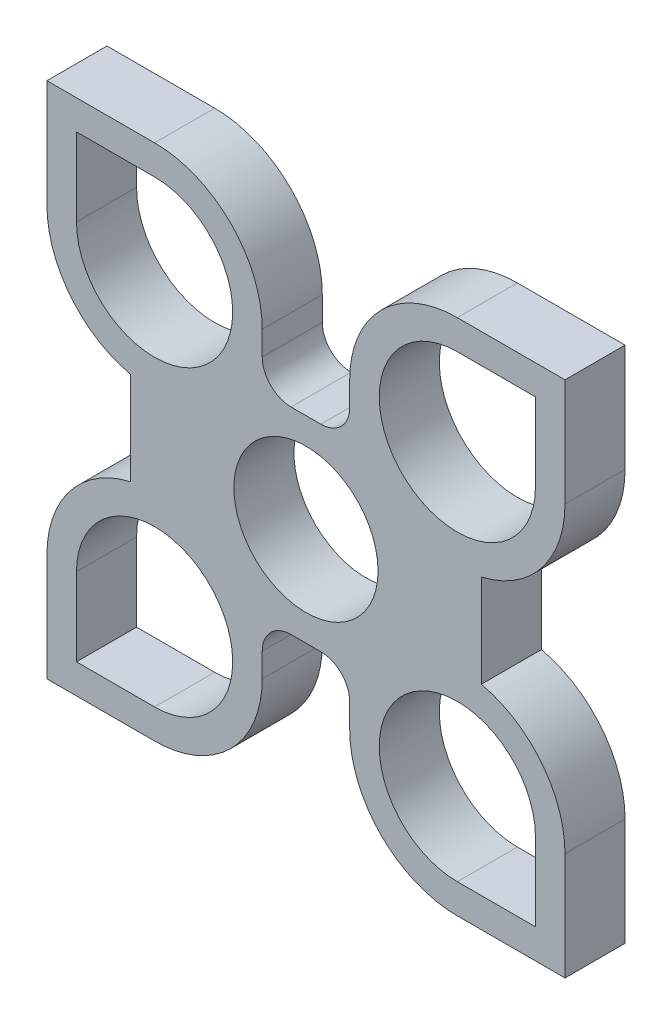
from build123d import *

# Parameters (mm, degrees)
SKETCH2_R           = 30
BOSS_EXTRUDE1_DEPTH = 25


with BuildPart() as part:
    # Sketch2 → Boss-Extrude1 (new body)
    with BuildSketch(Plane.XY):
        with BuildLine():
            Line((63, 107.8), (107.8, 107.8))
            Line((107.8, 107.8), (107.8, 63))
            ThreePointArc((107.8, 63), (98.035981505, 35.080114613), (73, 19.330330892))
            Line((73, 19.330330892), (73, -19.330330892))
            ThreePointArc((73, -19.330330892), (98.035981505, -35.080114613), (107.8, -63))
            Line((107.8, -63), (107.8, -107.8))
            Line((107.8, -107.8), (63, -107.8))
            ThreePointArc((63, -107.8), (31.321616203, -94.678383797), (18.2, -63))
            Line((18.2, -63), (18.2, -53))
            ThreePointArc((18.2, -53), (14.685281374, -44.514718626), (6.2, -41))
            Line((6.2, -41), (-6.2, -41))
            ThreePointArc((-6.2, -41), (-14.685281374, -44.514718626), (-18.2, -53))
            Line((-18.2, -53), (-18.2, -63))
            ThreePointArc((-18.2, -63), (-31.321616203, -94.678383797), (-63, -107.8))
            Line((-63, -107.8), (-107.8, -107.8))
            Line((-107.8, -107.8), (-107.8, -63))
            ThreePointArc((-107.8, -63), (-98.035981505, -35.080114613), (-73, -19.330330892))
            Line((-73, -19.330330892), (-73, 19.330330892))
            ThreePointArc((-73, 19.330330892), (-98.035981505, 35.080114613), (-107.8, 63))
            Line((-107.8, 63), (-107.8, 107.8))
            Line((-107.8, 107.8), (-63, 107.8))
            ThreePointArc((-63, 107.8), (-31.321616203, 94.678383797), (-18.2, 63))
            Line((-18.2, 63), (-18.2, 53))
            ThreePointArc((-18.2, 53), (-14.685281374, 44.514718626), (-6.2, 41))
            Line((-6.2, 41), (6.2, 41))
            ThreePointArc((6.2, 41), (14.685281374, 44.514718626), (18.2, 53))
            Line((18.2, 53), (18.2, 63))
            ThreePointArc((18.2, 63), (31.321616203, 94.678383797), (63, 107.8))
        make_face()
        Circle(SKETCH2_R, mode=Mode.SUBTRACT)
        with BuildLine():
            Line((63, 95.5), (95.5, 95.5))
            Line((95.5, 95.5), (95.5, 63))
            ThreePointArc((95.5, 63), (40.019029611, 40.019029611), (63, 95.5))
        make_face(mode=Mode.SUBTRACT)
        with BuildLine():
            Line((95.5, -95.5), (95.5, -63))
            ThreePointArc((95.5, -63), (40.019029611, -40.019029611), (63, -95.5))
            Line((63, -95.5), (95.5, -95.5))
        make_face(mode=Mode.SUBTRACT)
        with BuildLine():
            Line((-63, -95.5), (-95.5, -95.5))
            Line((-95.5, -95.5), (-95.5, -63))
            ThreePointArc((-95.5, -63), (-40.019029611, -40.019029611), (-63, -95.5))
        make_face(mode=Mode.SUBTRACT)
        with BuildLine():
            Line((-95.5, 95.5), (-95.5, 63))
            ThreePointArc((-95.5, 63), (-40.019029611, 40.019029611), (-63, 95.5))
            Line((-63, 95.5), (-95.5, 95.5))
        make_face(mode=Mode.SUBTRACT)
    extrude(amount=BOSS_EXTRUDE1_DEPTH)


solid = part.part
